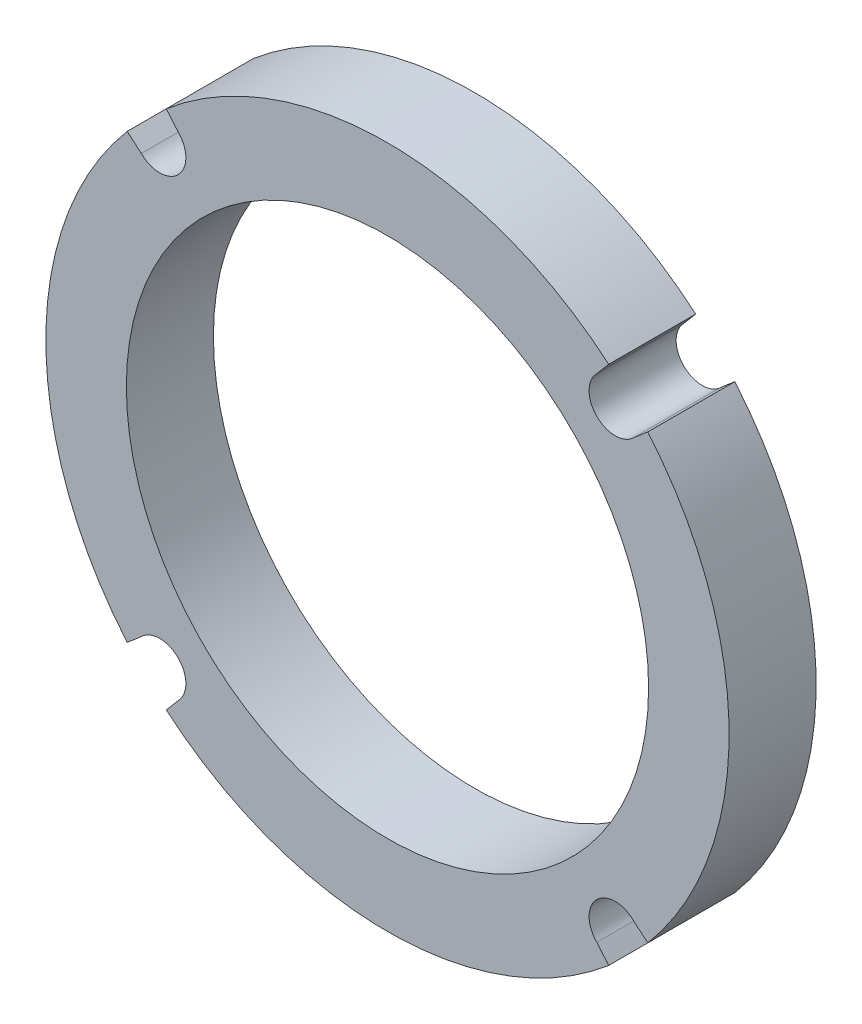
from build123d import *

# Parameters (mm, degrees)
EXTRUDE_1_DEPTH     = 10
SKETCH_2_R          = 30
CUT_EXTRUDE_1_DEPTH = 10


with BuildPart() as part:
    # 草图1 → 凸台-拉伸1 (new body)
    with BuildSketch(Plane.XY):
        with BuildLine():
            Line((-24.04163056, 28.284271247), (-25.420200489, 29.906118222))
            ThreePointArc((-25.420200489, 29.906118222), (0, 39.25), (25.420200489, 29.906118222))
            Line((25.420200489, 29.906118222), (24.04163056, 28.284271247))
            ThreePointArc((24.04163056, 28.284271247), (24.04163056, 24.04163056), (28.284271247, 24.04163056))
            Line((28.284271247, 24.04163056), (29.906118222, 25.420200489))
            ThreePointArc((29.906118222, 25.420200489), (39.25, 0), (29.906118222, -25.420200489))
            Line((29.906118222, -25.420200489), (28.284271247, -24.04163056))
            ThreePointArc((28.284271247, -24.04163056), (24.04163056, -24.04163056), (24.04163056, -28.284271247))
            Line((24.04163056, -28.284271247), (25.420200489, -29.906118222))
            ThreePointArc((25.420200489, -29.906118222), (0, -39.25), (-25.420200489, -29.906118222))
            Line((-25.420200489, -29.906118222), (-24.04163056, -28.284271247))
            ThreePointArc((-24.04163056, -28.284271247), (-24.04163056, -24.04163056), (-28.284271247, -24.04163056))
            Line((-28.284271247, -24.04163056), (-29.906118222, -25.420200489))
            ThreePointArc((-29.906118222, -25.420200489), (-39.25, 0), (-29.906118222, 25.420200489))
            Line((-29.906118222, 25.420200489), (-28.284271247, 24.04163056))
            ThreePointArc((-28.284271247, 24.04163056), (-24.04163056, 24.04163056), (-24.04163056, 28.284271247))
        make_face()
    extrude(amount=EXTRUDE_1_DEPTH)

    # 草图2 → 切除-拉伸1 (cut)
    with BuildSketch(Plane(origin=(0, 0, 0), x_dir=(-1, 0, 0), z_dir=(0, 0, -1))):
        Circle(SKETCH_2_R)
    extrude(amount=-CUT_EXTRUDE_1_DEPTH, mode=Mode.SUBTRACT)


solid = part.part
